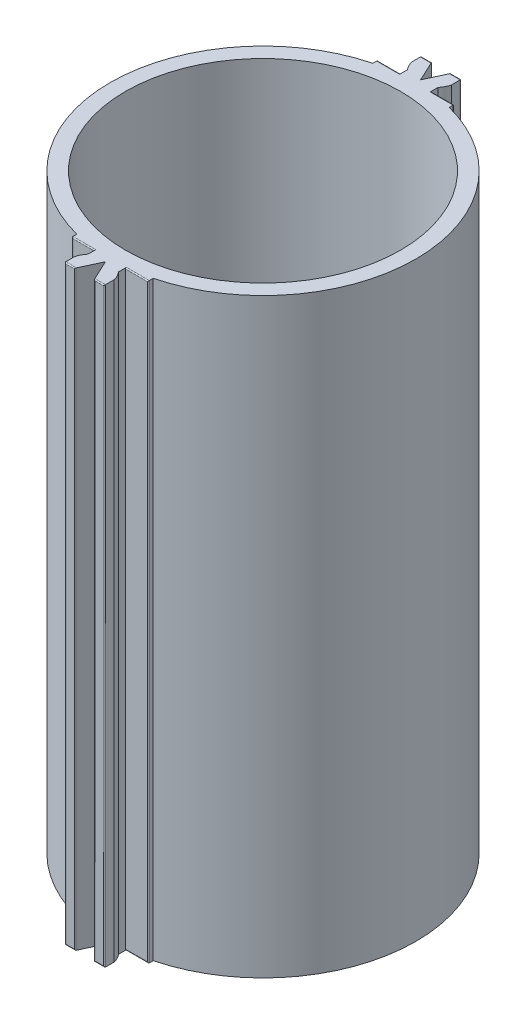
from build123d import *

# Parameters (mm, degrees)
SKETCH_1_R             = 15
SKETCH_1_R_2           = 13.5
EXTRUDE_1_DEPTH        = 58
EXTRUDE_2_DEPTH        = 58
EXTRUDE_3_DEPTH        = 58
FILLET_1_R             = 0.1
MIRROR_2_COPY_1_DEPTH  = 58
FILLET_1_OF_MIRROR_2_R = 0.1


with BuildPart() as part:
    # 草图1 → 凸台-拉伸1 (new body)
    with BuildSketch(Plane(origin=(0, 0, 0), x_dir=(1, 0, 0), z_dir=(0, 1, 0))):
        with Locations(Location((0, 0, 0), (0, 0, 90))):
            Circle(SKETCH_1_R)
        with Locations(Location((0, 0, 0), (0, 0, 90))):
            Circle(SKETCH_1_R_2, mode=Mode.SUBTRACT)
    extrude(amount=EXTRUDE_1_DEPTH)

    # 草图10 → 凸台-拉伸2 (add)
    with BuildSketch(Plane(origin=(0, 0, 0), x_dir=(1, 0, 0), z_dir=(0, 1, 0))):
        with BuildLine():
            Line((0, 15), (3.75, 15))
            Line((3.75, 15), (3.75, 14.523687548))
            ThreePointArc((3.75, 14.523687548), (1.890064387, 14.880445444), (0, 15))
        make_face()
    extrude_2 = extrude(amount=EXTRUDE_2_DEPTH)

    # 镜向1: 凸台-拉伸2 across plane
    add(extrude_2.mirror(Plane(origin=(0, 0, 0), x_dir=(0, 0, 1), z_dir=(1, 0, 0))))

    # 草图11 → 凸台-拉伸3 (add)
    with BuildSketch(Plane(origin=(0, 0, 0), x_dir=(1, 0, 0), z_dir=(0, 1, 0))):
        with BuildLine():
            Line((-1.5, 15), (1.5, 15))
            Line((1.5, 15), (1.5, 15.677124344))
            ThreePointArc((1.5, 15.677124344), (1.780042303, 16.088161527), (1.95, 16.555590279))
            Line((1.95, 16.555590279), (1.95, 17.5))
            Line((1.95, 17.5), (0.95, 17.5))
            Line((0.95, 17.5), (0, 15.462718426))
            Line((0, 15.462718426), (-0.95, 17.5))
            Line((-0.95, 17.5), (-1.95, 17.5))
            Line((-1.95, 17.5), (-1.95, 16.555590279))
            ThreePointArc((-1.95, 16.555590279), (-1.780042303, 16.088161527), (-1.5, 15.677124344))
            Line((-1.5, 15.677124344), (-1.5, 15))
        make_face()
    extrude_3 = extrude(amount=EXTRUDE_3_DEPTH)

    # 圆角1
    fillet_1_edges = [part.edges().sort_by_distance(p)[0] for p in [
        (-0.95, 29, -17.5),
        (-1.45, 58, -17.5),
        (-1.95, 29, -17.5),
        (-1.45, 0, -17.5),
        (1.95, 29, -17.5),
        (1.45, 58, -17.5),
        (0.95, 29, -17.5),
        (1.45, 0, -17.5),
        (-2.625, 58, -15),
        (-2.625, 0, -15),
        (2.625, 58, -15),
        (2.625, 0, -15),
        (3.75, 29, -15),
        (-3.75, 29, -15),
    ]]
    fillet(fillet_1_edges, radius=FILLET_1_R)

    # 镜向2: 凸台-拉伸2, 凸台-拉伸3 across plane
    add(extrude_2.mirror(Plane.XY))
    add(extrude_3.mirror(Plane.XY))

    # 镜向2 copy 1 sketch → 镜向2 copy 1 (add)
    with BuildSketch(Plane(origin=(0, 0, 0), x_dir=(-1, 0, 0), z_dir=(0, 1, 0))):
        with BuildLine():
            Line((0, 15), (3.75, 15))
            Line((3.75, 15), (3.75, 14.523687548))
            ThreePointArc((3.75, 14.523687548), (1.890064387, 14.880445444), (0, 15))
        make_face()
    extrude(amount=MIRROR_2_COPY_1_DEPTH)

    # 圆角1 of 镜向2
    fillet_1_of_mirror_2_edges = [part.edges().sort_by_distance(p)[0] for p in [
        (-0.95, 29, 17.5),
        (-1.45, 58, 17.5),
        (-1.95, 29, 17.5),
        (-1.45, 0, 17.5),
        (1.95, 29, 17.5),
        (1.45, 58, 17.5),
        (0.95, 29, 17.5),
        (1.45, 0, 17.5),
        (-2.625, 58, 15),
        (-2.625, 0, 15),
        (2.625, 58, 15),
        (2.625, 0, 15),
        (3.75, 29, 15),
        (-3.75, 29, 15),
    ]]
    fillet(fillet_1_of_mirror_2_edges, radius=FILLET_1_OF_MIRROR_2_R)


solid = part.part
